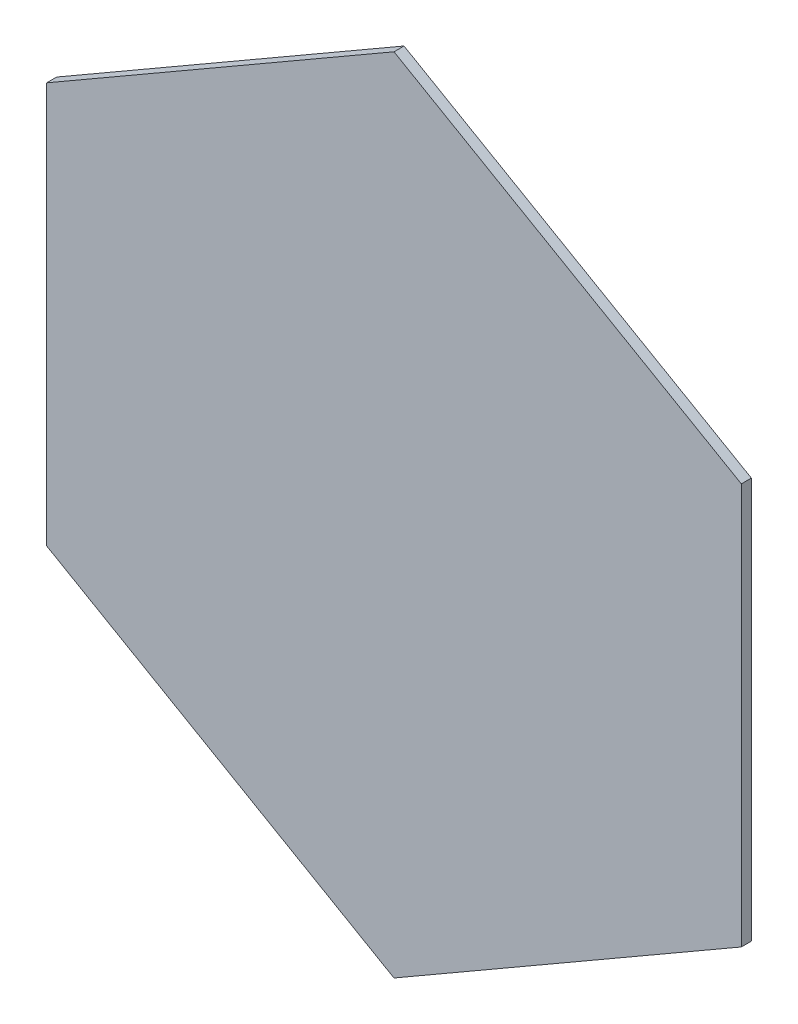
from build123d import *

# Parameters (mm, degrees)
RESSALTO_EXTRUS_O1_DEPTH = 3


with BuildPart() as part:
    # Esboço1 → Ressalto-extrusão1 (new body)
    with BuildSketch(Plane.XY):
        Polygon((0, 120), (-103.923048454, 60), (-103.923048454, -60), (0, -120), (103.923048454, -60), (103.923048454, 60), align=None)
    extrude(amount=RESSALTO_EXTRUS_O1_DEPTH)


solid = part.part
